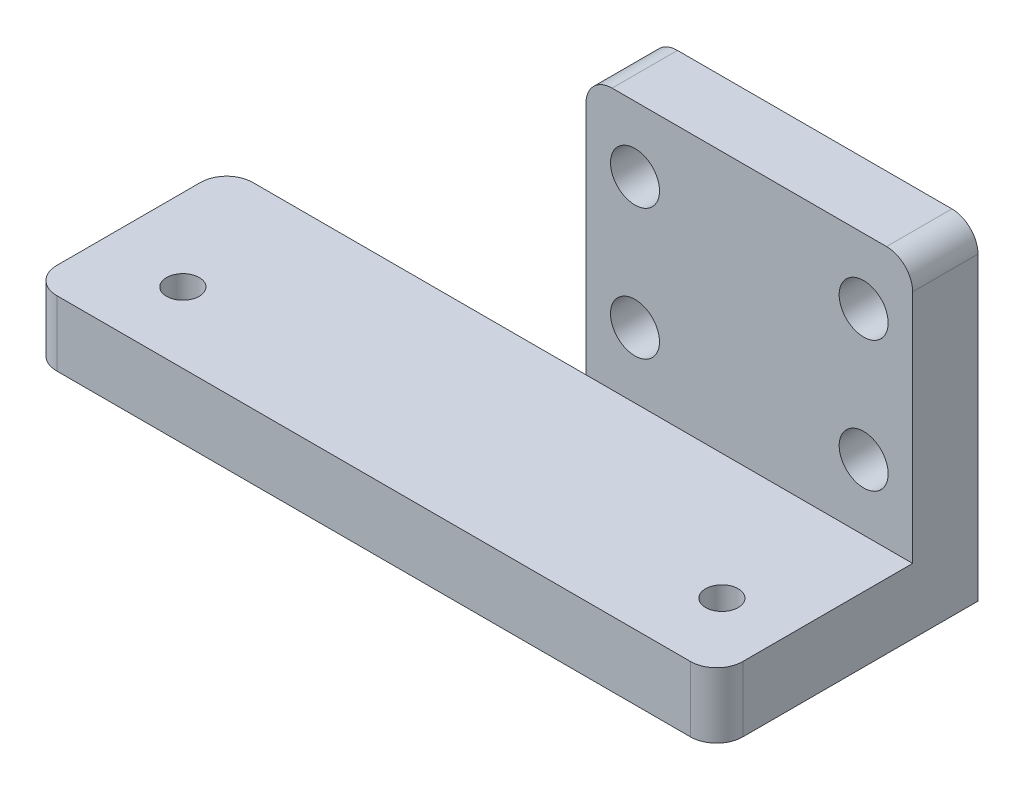
from build123d import *

# Parameters (mm, degrees)
SKETCH1_W           = 31.75
SKETCH1_H           = 31.75
SKETCH1_R           = 2.38125
BOSS_EXTRUDE1_DEPTH = 6.35
SKETCH2_W           = 66.675
SKETCH2_H           = 6.35
BOSS_EXTRUDE2_DEPTH = 19.05
SKETCH3_R           = 1.5875
CUT_EXTRUDE1_DEPTH  = 63.217039467
FILLET1_R           = 2.54


with BuildPart() as part:
    # Sketch1 → Boss-Extrude1 (new body)
    with BuildSketch(Plane.XY):
        Rectangle(SKETCH1_W, SKETCH1_H)
        with Locations((-11.1125, -3.175)):
            Circle(SKETCH1_R, mode=Mode.SUBTRACT)
        with Locations((-11.1125, 9.525)):
            Circle(SKETCH1_R, mode=Mode.SUBTRACT)
        with Locations((11.1125, 9.525)):
            Circle(SKETCH1_R, mode=Mode.SUBTRACT)
        with Locations((11.1125, -3.175)):
            Circle(SKETCH1_R, mode=Mode.SUBTRACT)
    extrude(amount=BOSS_EXTRUDE1_DEPTH)

    # Sketch2 → Boss-Extrude2 (add)
    with BuildSketch(Plane.XY.offset(6.35)):
        with Locations((-17.4625, -12.7)):
            Rectangle(SKETCH2_W, SKETCH2_H)
    extrude(amount=BOSS_EXTRUDE2_DEPTH)

    # Sketch3 → Cut-Extrude1 (cut, through all)
    with BuildSketch(Plane(origin=(0, -9.525, 0), x_dir=(1, 0, 0), z_dir=(0, 1, 0))):
        with Locations(Location((9.525, -18.542, 0), (0, 0, 270))):
            Circle(SKETCH3_R)
        with Locations(Location((-42.8625, -18.542, 0), (0, 0, 270))):
            Circle(SKETCH3_R)
    extrude(amount=-CUT_EXTRUDE1_DEPTH, mode=Mode.SUBTRACT)

    # Fillet1
    fillet1_edges = [part.edges().sort_by_distance(p)[0] for p in [
        (-50.8, -12.7, 6.35),
        (-50.8, -12.7, 25.4),
        (15.875, -12.7, 25.4),
        (-15.875, 15.875, 3.175),
        (15.875, 15.875, 3.175),
    ]]
    fillet(fillet1_edges, radius=FILLET1_R)


solid = part.part
